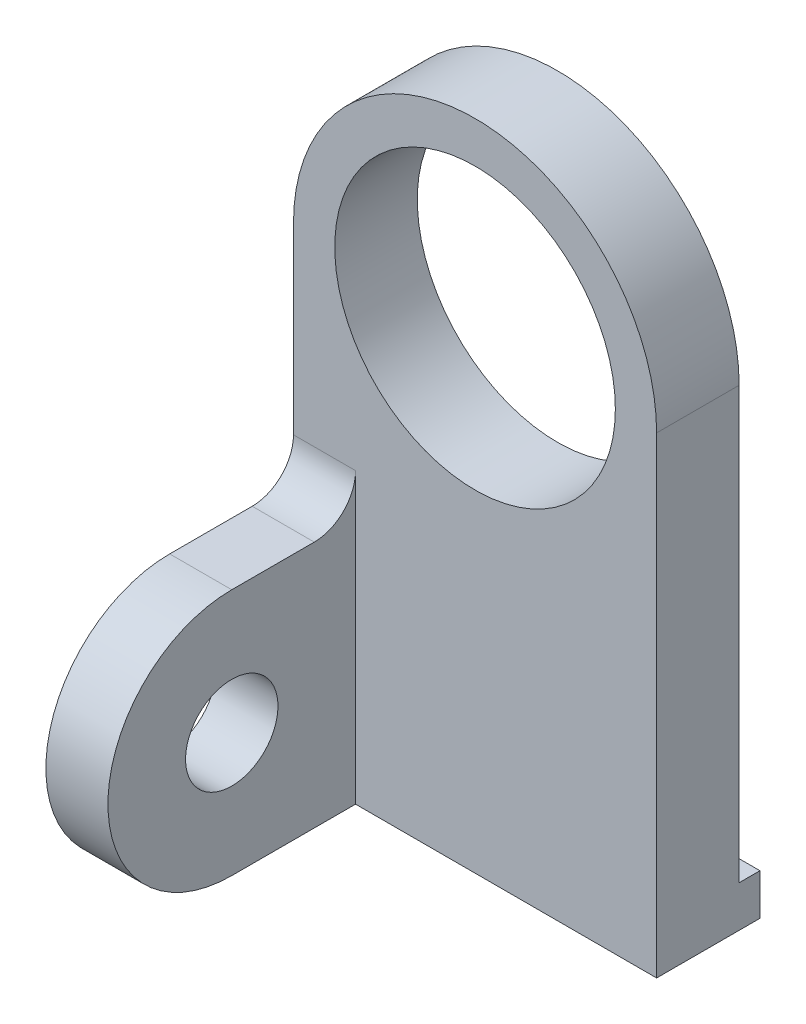
from build123d import *

# Parameters (mm, degrees)
SKETCH2_R           = 10.795
BOSS_EXTRUDE1_DEPTH = 6.35
SKETCH4_W           = 27.94
SKETCH4_H           = 3.175
BOSS_EXTRUDE2_DEPTH = 7.9502
SKETCH5_R           = 3.556
BOSS_EXTRUDE3_DEPTH = 4.7752
FILLET2_R           = 3.175


with BuildPart() as part:
    # Sketch2 → Boss-Extrude1 (new body)
    with BuildSketch(Plane.XY):
        with BuildLine():
            Line((-13.97, 0), (-13.97, -33.147))
            Line((-13.97, -33.147), (13.97, -33.147))
            Line((13.97, -33.147), (13.97, 0))
            ThreePointArc((13.97, 0), (0, 13.97), (-13.97, 0))
        make_face()
        Circle(SKETCH2_R, mode=Mode.SUBTRACT)
    extrude(amount=BOSS_EXTRUDE1_DEPTH)

    # Sketch4 → Boss-Extrude2 (add)
    with BuildSketch(Plane.XY.offset(6.35)):
        with Locations((0, -34.7345)):
            Rectangle(SKETCH4_W, SKETCH4_H)
    extrude(amount=-BOSS_EXTRUDE2_DEPTH)

    # Sketch5 → Boss-Extrude3 (add)
    with BuildSketch(Plane.ZY.offset(13.97)):
        with BuildLine():
            Line((6.35, -36.322), (15.875, -36.322))
            ThreePointArc((15.875, -36.322), (25.4, -26.797), (15.875, -17.272))
            Line((15.875, -17.272), (6.35, -17.272))
            Line((6.35, -17.272), (6.35, -36.322))
        make_face()
        with Locations((15.875, -26.797)):
            Circle(SKETCH5_R, mode=Mode.SUBTRACT)
    extrude(amount=-BOSS_EXTRUDE3_DEPTH)

    # Fillet2
    fillet2_edges = [part.edges().sort_by_distance(p)[0] for p in [
        (-11.5824, -17.272, 6.35),
    ]]
    fillet(fillet2_edges, radius=FILLET2_R)


solid = part.part
